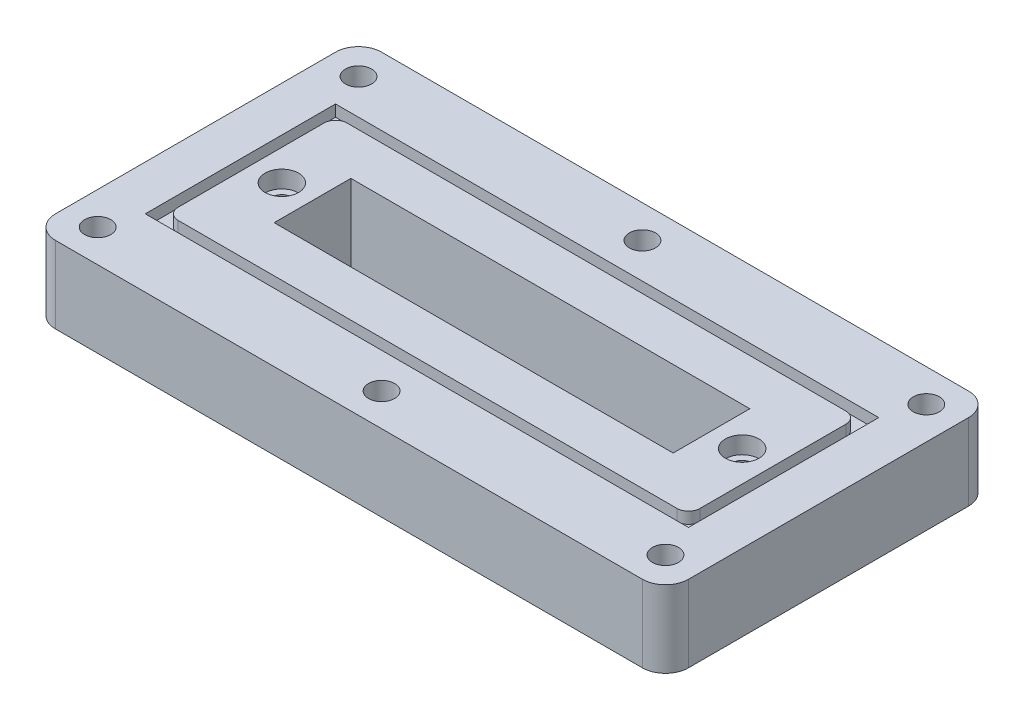
from build123d import *

# Parameters (mm, degrees)
SKETCH1_W                                      = 104.775
SKETCH1_H                                      = 53.975
BOSS_EXTRUDE1_DEPTH                            = 12.7
SKETCH3_W                                      = 89.916
SKETCH3_H                                      = 31.496
SKETCH3_W_2                                    = 86.36
SKETCH3_H_2                                    = 27.94
CUT_EXTRUDE1_DEPTH                             = 1.905
FILLET1_R                                      = 1.905
SKETCH4_R                                      = 2.159
CUT_EXTRUDE2_DEPTH                             = 61.283209209
SKETCH8_R                                      = 3.6195
CUT_EXTRUDE3_DEPTH                             = 4.572
FILLET2_R                                      = 3.81
SKETCH13_W                                     = 66.04
SKETCH13_H                                     = 12.7
CUT_EXTRUDE4_DEPTH                             = 61.283209209
CBORE_FOR_4_SOCKET_HEAD_CAP_SCREW3_D           = 3.2639
CBORE_FOR_4_SOCKET_HEAD_CAP_SCREW3_CBORE_D     = 5.55752
CBORE_FOR_4_SOCKET_HEAD_CAP_SCREW3_CBORE_DEPTH = 2.8448


with BuildPart() as part:
    # Sketch1 → Boss-Extrude1 (new body)
    with BuildSketch(Plane(origin=(0, 0, 0), x_dir=(1, 0, 0), z_dir=(0, 1, 0))):
        Rectangle(SKETCH1_W, SKETCH1_H)
    extrude(amount=BOSS_EXTRUDE1_DEPTH)

    # Sketch3 → Cut-Extrude1 (cut)
    with BuildSketch(Plane(origin=(0, 12.7, 0), x_dir=(1, 0, 0), z_dir=(0, 1, 0))):
        Rectangle(SKETCH3_W, SKETCH3_H)
        Rectangle(SKETCH3_W_2, SKETCH3_H_2, mode=Mode.SUBTRACT)
    extrude(amount=-CUT_EXTRUDE1_DEPTH, mode=Mode.SUBTRACT)

    # Fillet1
    fillet1_edges = [part.edges().sort_by_distance(p)[0] for p in [
        (43.18, 11.7475, 13.97),
        (-43.18, 11.7475, 13.97),
        (-43.18, 11.7475, -13.97),
        (43.18, 11.7475, -13.97),
    ]]
    fillet(fillet1_edges, radius=FILLET1_R)

    # Sketch4 → Cut-Extrude2 (cut, through all)
    with BuildSketch(Plane.XZ):
        with Locations(Location((-46.99, 21.59, 0), (0, 0, 270))):
            Circle(SKETCH4_R)
        with Locations(Location((46.99, 21.59, 0), (0, 0, 270))):
            Circle(SKETCH4_R)
        with Locations(Location((-46.99, -21.59, 0), (0, 0, 270))):
            Circle(SKETCH4_R)
        with Locations(Location((46.99, -21.59, 0), (0, 0, 270))):
            Circle(SKETCH4_R)
        with Locations(Location((0, 21.59, 0), (0, 0, 270))):
            Circle(SKETCH4_R)
        with Locations(Location((0, -21.59, 0), (0, 0, 270))):
            Circle(SKETCH4_R)
    extrude(amount=-CUT_EXTRUDE2_DEPTH, mode=Mode.SUBTRACT)

    # Sketch8 → Cut-Extrude3 (cut)
    with BuildSketch(Plane.XZ):
        with Locations(Location((-46.99, 21.59, 0), (0, 0, 270))):
            Circle(SKETCH8_R)
        with Locations(Location((0, 21.59, 0), (0, 0, 270))):
            Circle(SKETCH8_R)
        with Locations(Location((46.99, 21.59, 0), (0, 0, 270))):
            Circle(SKETCH8_R)
        with Locations(Location((46.99, -21.59, 0), (0, 0, 270))):
            Circle(SKETCH8_R)
        with Locations(Location((0, -21.59, 0), (0, 0, 270))):
            Circle(SKETCH8_R)
        with Locations(Location((-46.99, -21.59, 0), (0, 0, 270))):
            Circle(SKETCH8_R)
    extrude(amount=-CUT_EXTRUDE3_DEPTH, mode=Mode.SUBTRACT)

    # Fillet2
    fillet2_edges = [part.edges().sort_by_distance(p)[0] for p in [
        (52.3875, 6.35, 26.9875),
        (-52.3875, 6.35, 26.9875),
        (-52.3875, 6.35, -26.9875),
        (52.3875, 6.35, -26.9875),
    ]]
    fillet(fillet2_edges, radius=FILLET2_R)

    # Sketch13 → Cut-Extrude4 (cut, through all)
    with BuildSketch(Plane.XZ):
        Rectangle(SKETCH13_W, SKETCH13_H)
    extrude(amount=-CUT_EXTRUDE4_DEPTH, mode=Mode.SUBTRACT)

    # CBORE for #4 Socket Head Cap Screw3 (through all)
    with Locations(Plane(origin=(0, 12.7, 0), x_dir=(1, 0, 0), z_dir=(0, 1, 0))):
        with Locations((-38.1, 0), (38.1, 0)):
            CounterBoreHole(CBORE_FOR_4_SOCKET_HEAD_CAP_SCREW3_D / 2, CBORE_FOR_4_SOCKET_HEAD_CAP_SCREW3_CBORE_D / 2, CBORE_FOR_4_SOCKET_HEAD_CAP_SCREW3_CBORE_DEPTH)


solid = part.part
